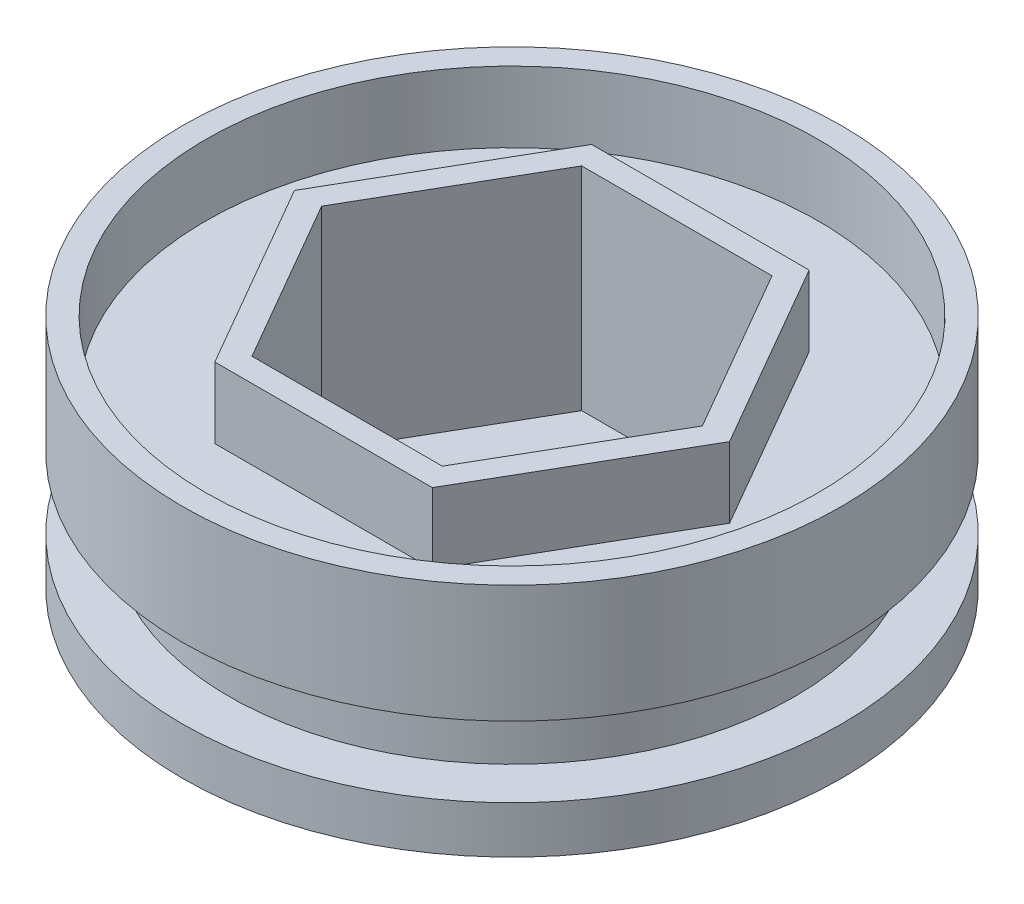
from build123d import *

# Parameters (mm, degrees)
SKETCH1_R           = 14
BOSS_EXTRUDE1_DEPTH = 10
SKETCH2_R           = 13
CUT_EXTRUDE1_DEPTH  = 3
BOSS_EXTRUDE2_DEPTH = 3
CUT_EXTRUDE2_DEPTH  = 9
SKETCH5_W           = 2
SKETCH5_H           = 3


with BuildPart() as part:
    # Sketch1 → Boss-Extrude1 (new body)
    with BuildSketch(Plane(origin=(0, 0, 0), x_dir=(1, 0, 0), z_dir=(0, 1, 0))):
        with Locations(Location((0, 0, 0), (0, 0, 270))):
            Circle(SKETCH1_R)
    extrude(amount=BOSS_EXTRUDE1_DEPTH)

    # Sketch2 → Cut-Extrude1 (cut)
    with BuildSketch(Plane(origin=(0, 10, 0), x_dir=(1, 0, 0), z_dir=(0, 1, 0))):
        with Locations(Location((0, 0, 0), (0, 0, 270))):
            Circle(SKETCH2_R)
    extrude(amount=-CUT_EXTRUDE1_DEPTH, mode=Mode.SUBTRACT)

    # Sketch3 → Boss-Extrude2 (add)
    with BuildSketch(Plane(origin=(0, 7, 0), x_dir=(1, 0, 0), z_dir=(0, 1, 0))):
        Polygon((9.237604307, 0), (4.618802154, 8), (-4.618802154, 8), (-9.237604307, 0), (-4.618802154, -8), (4.618802154, -8), align=None)
    extrude(amount=BOSS_EXTRUDE2_DEPTH)

    # Sketch4 → Cut-Extrude2 (cut)
    with BuildSketch(Plane(origin=(0, 10, 0), x_dir=(1, 0, 0), z_dir=(0, 1, 0))):
        Polygon((8.082903769, 0), (4.041451884, 7), (-4.041451884, 7), (-8.082903769, 0), (-4.041451884, -7), (4.041451884, -7), align=None)
    extrude(amount=-CUT_EXTRUDE2_DEPTH, mode=Mode.SUBTRACT)

    # Cut-Sweep1: sweep along a path in Sketch6
    with BuildLine(Plane(origin=(0, 3.5, 0), x_dir=(1, 0, 0), z_dir=(0, 1, 0))) as cut_sweep1_path:
        CenterArc((0, 0), 13, 0, 360)
    # Sketch5 → Cut-Sweep1 (sweep, cut)
    with BuildSketch(Plane.XY):
        with Locations((13, 3.5)):
            Rectangle(SKETCH5_W, SKETCH5_H)
    sweep(path=cut_sweep1_path.line, mode=Mode.SUBTRACT)


solid = part.part
